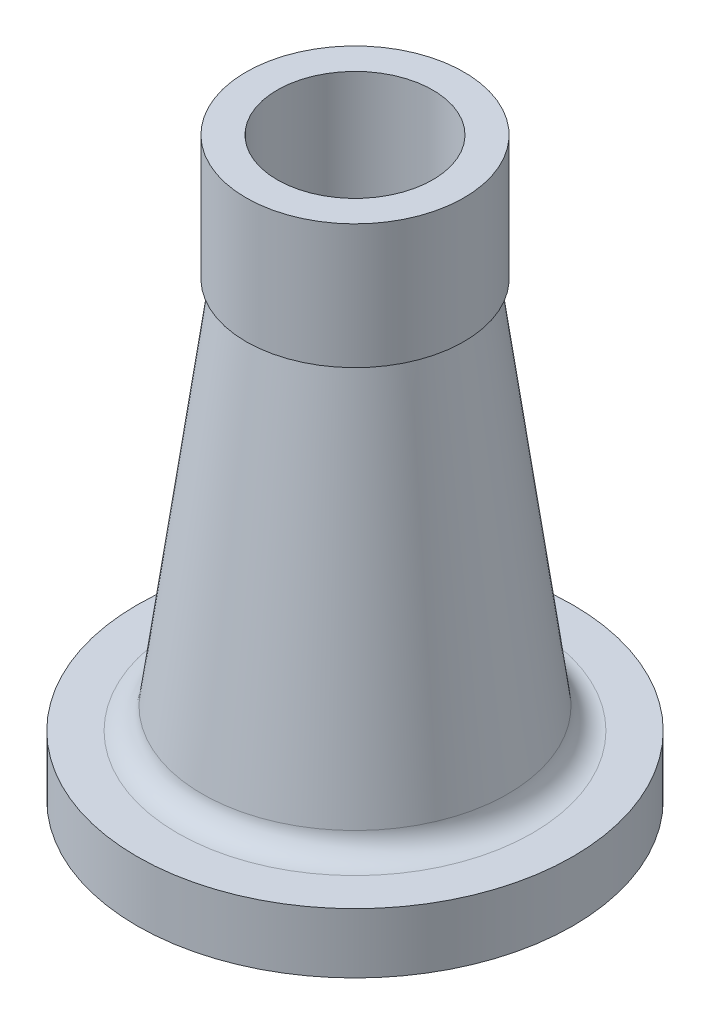
from build123d import *

# Parameters (mm, degrees)
FILLET1_R = 8


with BuildPart() as part:
    # Sketch3 → Revolve1 (revolve)
    with BuildSketch(Plane.XY, mode=Mode.PRIVATE) as revolve1_sk:
        Polygon((50, 2.999634439), (50, 0), (70, 0), (70, 19.277093337), (50, 19.277093337), (33, 145), (35, 145), (35, 185), (24.988647403, 185), (24.988647403, 129.62), (42.11, 2.999634439), align=None)
    revolve(revolve1_sk.sketch.rotate(Axis((0, 280.66968572, 0), (0, -1, 0)), 90), axis=Axis((0, 280.66968572, 0), (0, -1, 0)))

    # Fillet1
    fillet1_edges = [part.edges().sort_by_distance(p)[0] for p in [
        (0, 19.277093337, -50),
    ]]
    fillet(fillet1_edges, radius=FILLET1_R)


solid = part.part
